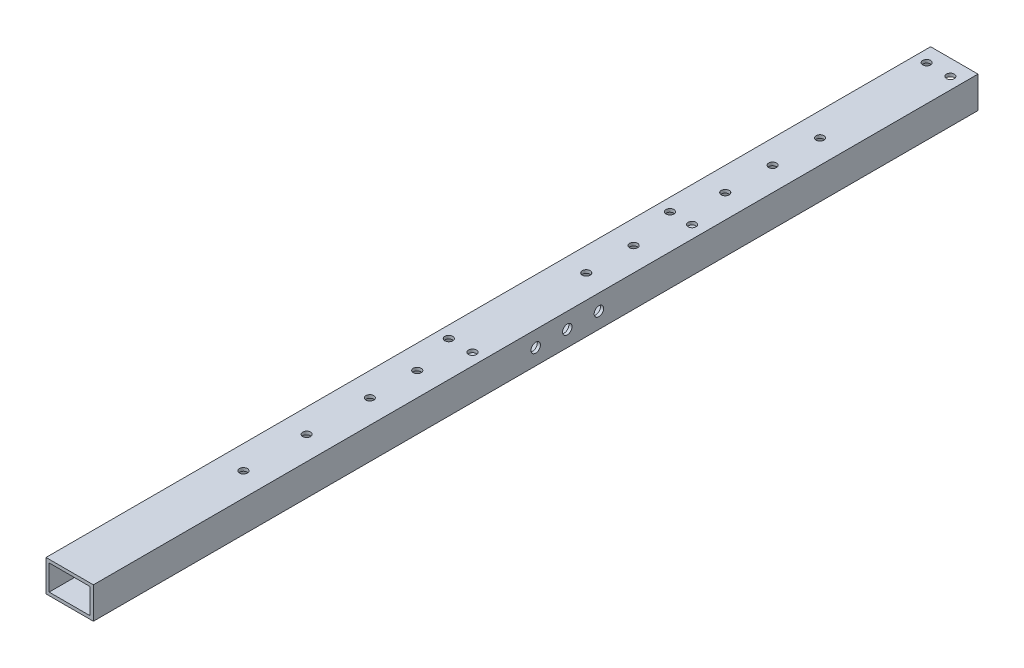
from build123d import *

# Parameters (mm, degrees)
SKETCH_1_W          = 30
SKETCH_1_H          = 20
SKETCH_1_W_2        = 26
SKETCH_1_H_2        = 16
EXTRUDE_1_DEPTH     = 560
SKETCH_3_R          = 2.5
CUT_EXTRUDE_2_DEPTH = 561.557757952
SKETCH_4_R          = 2.5
CUT_EXTRUDE_3_DEPTH = 561.557757952
SKETCH_7_R          = 3
CUT_EXTRUDE_5_DEPTH = 30
SKETCH_8_R          = 2.5
CUT_EXTRUDE_6_DEPTH = 30
SKETCH_10_R         = 2.5
CUT_EXTRUDE_7_DEPTH = 30
SKETCH_11_R         = 2.5
CUT_EXTRUDE_8_DEPTH = 30


with BuildPart() as part:
    # 草图1 → 凸台-拉伸1 (new body)
    with BuildSketch(Plane.XY):
        Rectangle(SKETCH_1_W, SKETCH_1_H)
        Rectangle(SKETCH_1_W_2, SKETCH_1_H_2, mode=Mode.SUBTRACT)
    extrude(amount=EXTRUDE_1_DEPTH)

    # 草图3 → 切除-拉伸2 (cut, through all)
    with BuildSketch(Plane(origin=(0, 10, 0), x_dir=(1, 0, 0), z_dir=(0, 1, 0))):
        with Locations(Location((-7.5, -10, 0), (0, 0, 180))):
            Circle(SKETCH_3_R)
        with Locations(Location((7.5, -10, 0), (0, 0, 180))):
            Circle(SKETCH_3_R)
    extrude(amount=-CUT_EXTRUDE_2_DEPTH, mode=Mode.SUBTRACT)

    # 草图4 → 切除-拉伸3 (cut, through all)
    with BuildSketch(Plane(origin=(0, 10, 0), x_dir=(1, 0, 0), z_dir=(0, 1, 0))):
        with Locations(Location((-7.5, -312.5, 0), (0, 0, 180))):
            Circle(SKETCH_4_R)
        with Locations(Location((7.5, -312.5, 0), (0, 0, 180))):
            Circle(SKETCH_4_R)
    extrude(amount=-CUT_EXTRUDE_3_DEPTH, mode=Mode.SUBTRACT)

    # 草图7 → 切除-拉伸5 (cut)
    with BuildSketch(Plane.ZY.offset(15)):
        with Locations(Location((260, 0, 0), (0, 0, 270))):
            Circle(SKETCH_7_R)
        with Locations(Location((280, 0, 0), (0, 0, 270))):
            Circle(SKETCH_7_R)
        with Locations(Location((240, 0, 0), (0, 0, 270))):
            Circle(SKETCH_7_R)
    extrude(amount=-CUT_EXTRUDE_5_DEPTH, mode=Mode.SUBTRACT)

    # 草图8 → 切除-拉伸6 (cut)
    with BuildSketch(Plane(origin=(0, 10, 0), x_dir=(1, 0, 0), z_dir=(0, 1, 0))):
        with Locations(Location((0, -370, 0), (0, 0, 270))):
            Circle(SKETCH_8_R)
        with Locations(Location((0, -450, 0), (0, 0, 270))):
            Circle(SKETCH_8_R)
        with Locations(Location((0, -410, 0), (0, 0, 270))):
            Circle(SKETCH_8_R)
        with Locations(Location((0, -340, 0), (0, 0, 270))):
            Circle(SKETCH_8_R)
    extrude(amount=-CUT_EXTRUDE_6_DEPTH, mode=Mode.SUBTRACT)

    # 草图10 → 切除-拉伸7 (cut)
    with BuildSketch(Plane(origin=(0, 10, 0), x_dir=(1, 0, 0), z_dir=(0, 1, 0))):
        with Locations(Location((-7, -173, 0), (0, 0, 270))):
            Circle(SKETCH_10_R)
        with Locations(Location((7, -173, 0), (0, 0, 270))):
            Circle(SKETCH_10_R)
    extrude(amount=-CUT_EXTRUDE_7_DEPTH, mode=Mode.SUBTRACT)

    # 草图11 → 切除-拉伸8 (cut)
    with BuildSketch(Plane(origin=(0, 10, 0), x_dir=(1, 0, 0), z_dir=(0, 1, 0))):
        with Locations(Location((0, -85, 0), (0, 0, 270))):
            Circle(SKETCH_11_R)
        with Locations(Location((0, -115, 0), (0, 0, 270))):
            Circle(SKETCH_11_R)
        with Locations(Location((0, -203, 0), (0, 0, 270))):
            Circle(SKETCH_11_R)
        with Locations(Location((0, -233, 0), (0, 0, 270))):
            Circle(SKETCH_11_R)
        with Locations(Location((0, -145, 0), (0, 0, 270))):
            Circle(SKETCH_11_R)
    extrude(amount=-CUT_EXTRUDE_8_DEPTH, mode=Mode.SUBTRACT)


solid = part.part
